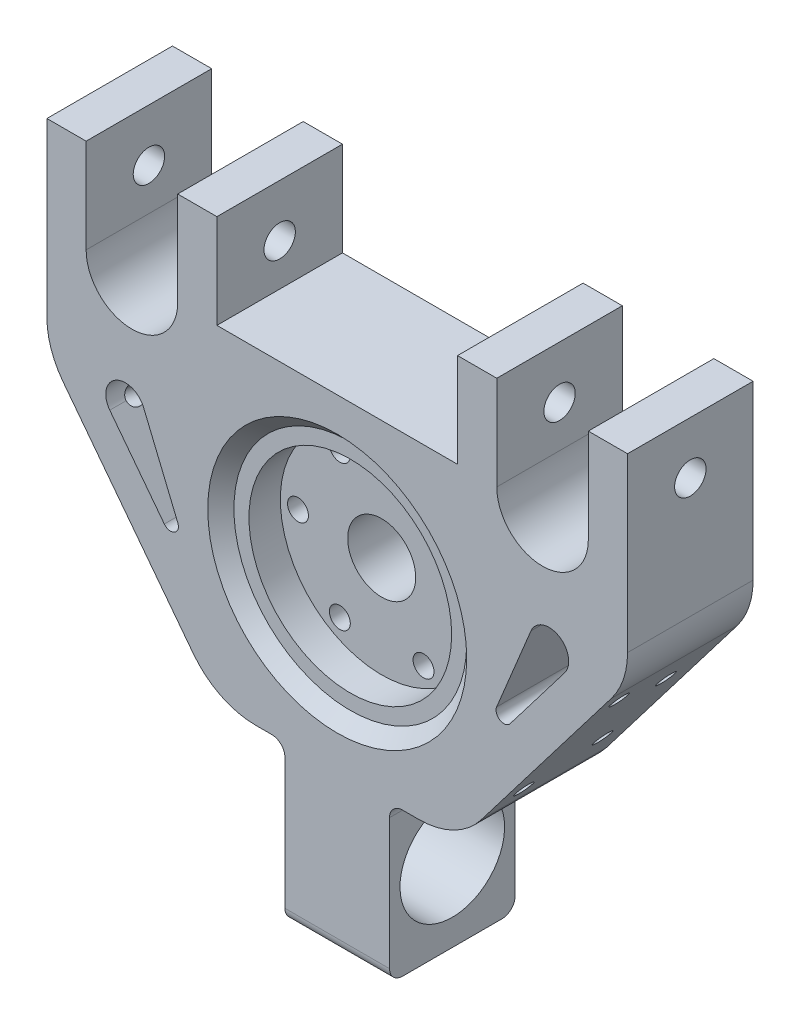
from build123d import *

# Parameters (mm, degrees)
DODANIE_WYCI_GNI_CIE1_DEPTH      = 13.5
DODANIE_WYCI_GNI_CIE1_DEPTH_BACK = 13.5
SZKIC1_W                         = 222
SZKIC1_H                         = 125
SZKIC1_R                         = 13
SZKIC1_R_2                       = 4
SZKIC4_W                         = 15
SZKIC4_H                         = 27
DODANIE_WYCI_GNI_CIE4_DEPTH      = 36
SZKIC13_R                        = 38.75
WYTNIJ_WYCI_GNI_CIE4_DEPTH       = 17
SZKIC15_R                        = 44.5
WYTNIJ_WYCI_GNI_CIE5_DEPTH       = 5
POCHYLENIE1_ANGLE                = 45
DODANIE_WYCI_GNI_CIE6_START      = 21
SZKIC16_R                        = 13
SZKIC16_R_2                      = 4
DODANIE_WYCI_GNI_CIE6_DEPTH      = 21
SZKIC5_R                         = 6
WYTNIJ_WYCI_GNI_CIE3_DEPTH       = 246.308988828
WYTNIJ_WYCI_GNI_CIE6_DEPTH       = 156.971952607
ZAOKR_GLENIE1_R                  = 30
ZAOKR_GLENIE2_R                  = 30
SZKIC19_W                        = 40
SZKIC19_H                        = 60
DODANIE_WYCI_GNI_CIE7_DEPTH      = 48
WYTNIJ_WYCI_GNI_CIE7_REACH       = 184.64
SZKIC23_R                        = 20
WYTNIJ_WYCI_GNI_CIE8_REACH       = 174.137
ZAOKR_GLENIE4_R                  = 5
ZAOKR_GLENIE5_R                  = 5
WYTNIJ_WYCI_GNI_CIE9_DEPTH       = 48
OTW_R_GWINTOWANY_M81_AT_2_COUNT  = 2
OTW_R_GWINTOWANY_M81_AT_2_PITCH  = 26
OTW_R_GWINTOWANY_M82_AT_2_COUNT  = 2
OTW_R_GWINTOWANY_M82_AT_2_PITCH  = 26


with BuildPart() as part:
    # Szkic1 → Dodanie-wyciągnięcie1 (new, two sides: drawn at the far end of the back side and taken through both)
    with BuildSketch(Plane.XY.offset(-DODANIE_WYCI_GNI_CIE1_DEPTH_BACK)):
        Rectangle(SZKIC1_W, SZKIC1_H)
        Circle(SZKIC1_R, mode=Mode.SUBTRACT)
        with Locations((-32, 0)):
            Circle(SZKIC1_R_2, mode=Mode.SUBTRACT)
        with Locations((-16, 27.712812921)):
            Circle(SZKIC1_R_2, mode=Mode.SUBTRACT)
        with Locations((16, 27.712812921)):
            Circle(SZKIC1_R_2, mode=Mode.SUBTRACT)
        with Locations((32, 0)):
            Circle(SZKIC1_R_2, mode=Mode.SUBTRACT)
        with Locations((16, -27.712812921)):
            Circle(SZKIC1_R_2, mode=Mode.SUBTRACT)
        with Locations((-16, -27.712812921)):
            Circle(SZKIC1_R_2, mode=Mode.SUBTRACT)
    extrude(amount=DODANIE_WYCI_GNI_CIE1_DEPTH + DODANIE_WYCI_GNI_CIE1_DEPTH_BACK)

    # Szkic4 → Dodanie-wyciągnięcie4 (add)
    with BuildSketch(Plane(origin=(0, 62.5, 0), x_dir=(1, 0, 0), z_dir=(0, 1, 0))):
        with Locations((-103.5, 0)):
            Rectangle(SZKIC4_W, SZKIC4_H)
        with Locations((-53.5, 0)):
            Rectangle(SZKIC4_W, SZKIC4_H)
        with Locations((53.5, 0)):
            Rectangle(SZKIC4_W, SZKIC4_H)
        with Locations((103.5, 0)):
            Rectangle(SZKIC4_W, SZKIC4_H)
    extrude(amount=DODANIE_WYCI_GNI_CIE4_DEPTH)

    # Szkic13 → Wytnij-wyciągnięcie4 (cut)
    with BuildSketch(Plane.XY.offset(13.5)):
        Circle(SZKIC13_R)
    extrude(amount=-WYTNIJ_WYCI_GNI_CIE4_DEPTH, mode=Mode.SUBTRACT)

    # Szkic15 → Wytnij-wyciągnięcie5 (cut)
    with BuildSketch(Plane.XY.offset(13.5)):
        Circle(SZKIC15_R)
    extrude(amount=-WYTNIJ_WYCI_GNI_CIE5_DEPTH, mode=Mode.SUBTRACT)

    # Pochylenie1
    pochylenie1_faces = [part.faces().sort_by_distance(p)[0] for p in [
        (-44.5, 0, 11),
    ]]
    draft(pochylenie1_faces, Plane.XY.offset(8.5), POCHYLENIE1_ANGLE)

    # Szkic16 → Dodanie-wyciągnięcie6 (add)
    with BuildSketch(Plane(origin=(0, 0, -13.5), x_dir=(-1, 0, 0), z_dir=(0, 0, -1)).offset(DODANIE_WYCI_GNI_CIE6_START)):
        Polygon((-111, 98.5), (-111, -62.5), (111, -62.5), (111, 98.5), (96, 98.5), (96, 62.5), (61, 62.5), (61, 98.5), (46, 98.5), (46, 62.5), (-46, 62.5), (-46, 98.5), (-61, 98.5), (-61, 62.5), (-96, 62.5), (-96, 98.5), align=None)
        with Locations(Location((0, 0, 0), (0, 0, 180))):
            Circle(SZKIC16_R, mode=Mode.SUBTRACT)
        with Locations(Location((32, 0, 0), (0, 0, 180))):
            Circle(SZKIC16_R_2, mode=Mode.SUBTRACT)
        with Locations(Location((16, 27.712812921, 0), (0, 0, 180))):
            Circle(SZKIC16_R_2, mode=Mode.SUBTRACT)
        with Locations(Location((-16, 27.712812921, 0), (0, 0, 180))):
            Circle(SZKIC16_R_2, mode=Mode.SUBTRACT)
        with Locations(Location((-32, 0, 0), (0, 0, 180))):
            Circle(SZKIC16_R_2, mode=Mode.SUBTRACT)
        with Locations(Location((-16, -27.712812921, 0), (0, 0, 180))):
            Circle(SZKIC16_R_2, mode=Mode.SUBTRACT)
        with Locations(Location((16, -27.712812921, 0), (0, 0, 180))):
            Circle(SZKIC16_R_2, mode=Mode.SUBTRACT)
    extrude(amount=-DODANIE_WYCI_GNI_CIE6_DEPTH)

    # Szkic5 → Wytnij-wyciągnięcie3 (cut, through all)
    with BuildSketch(Plane.ZY.offset(111)):
        with Locations((-10.5, 78.5)):
            Circle(SZKIC5_R)
    extrude(amount=-WYTNIJ_WYCI_GNI_CIE3_DEPTH, mode=Mode.SUBTRACT)

    # Szkic18 → Wytnij-wyciągnięcie6 (cut, through all)
    with BuildSketch(Plane(origin=(0, 0, -34.5), x_dir=(-1, 0, 0), z_dir=(0, 0, -1))):
        Polygon((111, 22.5), (46, -62.5), (111, -62.5), align=None)
        Polygon((-111, -62.5), (-46, -62.5), (-111, 22.5), align=None)
    extrude(amount=-WYTNIJ_WYCI_GNI_CIE6_DEPTH, mode=Mode.SUBTRACT)

    # Zaokrąglenie1
    zaokr_glenie1_edges = [part.edges().sort_by_distance(p)[0] for p in [
        (-111, 22.5, -10.5),
    ]]
    fillet(zaokr_glenie1_edges, radius=ZAOKR_GLENIE1_R)

    # Zaokrąglenie2
    zaokr_glenie2_edges = [part.edges().sort_by_distance(p)[0] for p in [
        (-46, -62.5, -10.5),
        (111, 22.5, -10.5),
        (46, -62.5, -10.5),
    ]]
    fillet(zaokr_glenie2_edges, radius=ZAOKR_GLENIE2_R)

    # Szkic19 → Dodanie-wyciągnięcie7 (add)
    with BuildSketch(Plane(origin=(0, 0, -34.5), x_dir=(-1, 0, 0), z_dir=(0, 0, -1))):
        with Locations((0, -92.5)):
            Rectangle(SZKIC19_W, SZKIC19_H)
    extrude(amount=-DODANIE_WYCI_GNI_CIE7_DEPTH)

    # Szkic23 → Wytnij-wyciągnięcie7 (cut, up to next)
    with BuildSketch(Plane(origin=(20, 0, 0), x_dir=(0, 0, -1), z_dir=(1, 0, 0)), mode=Mode.PRIVATE) as wytnij_wyci_gni_cie7_sk1:
        with Locations(Location((10.5, -92.5, 0), (0, 0, 90))):
            Circle(SZKIC23_R)
    wytnij_wyci_gni_cie7_tool1 = extrude(wytnij_wyci_gni_cie7_sk1.sketch, amount=-WYTNIJ_WYCI_GNI_CIE7_REACH, mode=Mode.PRIVATE) & part.part
    add(wytnij_wyci_gni_cie7_tool1.solids().sort_by_distance((20, -92.5, -10.5))[0], mode=Mode.SUBTRACT)

    # Szkic24 → Wytnij-wyciągnięcie8 (cut, up to next)
    with BuildSketch(Plane(origin=(0, 0, -34.5), x_dir=(-1, 0, 0), z_dir=(0, 0, -1)), mode=Mode.PRIVATE) as wytnij_wyci_gni_cie8_sk1:
        with BuildLine():
            Line((-96, 62.5), (-61, 62.5))
            ThreePointArc((-61, 62.5), (-78.5, 45), (-96, 62.5))
        make_face()
    wytnij_wyci_gni_cie8_tool1 = extrude(wytnij_wyci_gni_cie8_sk1.sketch, amount=-WYTNIJ_WYCI_GNI_CIE8_REACH, mode=Mode.PRIVATE) & part.part
    # Szkic24 → Wytnij-wyciągnięcie8 (cut, up to next)
    with BuildSketch(Plane(origin=(0, 0, -34.5), x_dir=(-1, 0, 0), z_dir=(0, 0, -1)), mode=Mode.PRIVATE) as wytnij_wyci_gni_cie8_sk2:
        with BuildLine():
            Line((61, 62.5), (96, 62.5))
            ThreePointArc((96, 62.5), (78.5, 45), (61, 62.5))
        make_face()
    wytnij_wyci_gni_cie8_tool2 = extrude(wytnij_wyci_gni_cie8_sk2.sketch, amount=-WYTNIJ_WYCI_GNI_CIE8_REACH, mode=Mode.PRIVATE) & part.part
    add(wytnij_wyci_gni_cie8_tool1.solids().sort_by_distance((78.5, 55.072769, -34.5))[0], mode=Mode.SUBTRACT)
    add(wytnij_wyci_gni_cie8_tool2.solids().sort_by_distance((-78.5, 55.072769, -34.5))[0], mode=Mode.SUBTRACT)

    # Zaokrąglenie4
    zaokr_glenie4_edges = [part.edges().sort_by_distance(p)[0] for p in [
        (20, -62.5, -10.5),
        (-20, -62.5, -10.5),
    ]]
    fillet(zaokr_glenie4_edges, radius=ZAOKR_GLENIE4_R)

    # Zaokrąglenie5
    zaokr_glenie5_edges = [part.edges().sort_by_distance(p)[0] for p in [
        (0, -122.5, -34.5),
        (0, -122.5, 13.5),
    ]]
    fillet(zaokr_glenie5_edges, radius=ZAOKR_GLENIE5_R)

    # Szkic25 → Wytnij-wyciągnięcie9 (cut)
    with BuildSketch(Plane.XY.offset(13.5)):
        with BuildLine():
            Line((-60.951491344, -10.353512592), (-74.069286372, 21.36621852))
            ThreePointArc((-74.069286372, 21.36621852), (-84.742802137, 24.999340902), (-86.957683747, 13.944124193))
            Line((-86.957683747, 13.944124193), (-66.106850294, -13.322350323))
            ThreePointArc((-66.106850294, -13.322350323), (-62.22665594, -14.099736361), (-60.951491344, -10.353512592))
        make_face()
        with BuildLine():
            Line((66.106850294, -13.322350323), (86.957683747, 13.944124193))
            ThreePointArc((86.957683747, 13.944124193), (84.742802137, 24.999340902), (74.069286372, 21.36621852))
            Line((74.069286372, 21.36621852), (60.951491344, -10.353512592))
            ThreePointArc((60.951491344, -10.353512592), (62.22665594, -14.099736361), (66.106850294, -13.322350323))
        make_face()
    extrude(amount=-WYTNIJ_WYCI_GNI_CIE9_DEPTH, mode=Mode.SUBTRACT)

    # Szkic28 → Otwór gwintowany M81 (revolve, cut)
    with BuildSketch(Plane(origin=(-92.067147824, -2.258345153, -20.15), x_dir=(0.6074501075707972, -0.7943578329771962, 0), z_dir=(0, 0, 1))):
        Polygon((0, 0), (0, 47.042926105), (3.4, 45), (3.4, 0), align=None)
    otw_r_gwintowany_m81 = revolve(axis=Axis((-97.111320063, -6.115653336, -20.15), (0.7943578329771961, 0.6074501075707972, 0)), mode=Mode.SUBTRACT)

    # Otwór gwintowany M81 at 2: Otwór gwintowany M81 ×2
    with Locations(*[Vector(-0.23363465675799897, 0.30552224345276774, 0.9230769230769231) * (i * OTW_R_GWINTOWANY_M81_AT_2_PITCH) for i in range(1, OTW_R_GWINTOWANY_M81_AT_2_COUNT)]):
        add(otw_r_gwintowany_m81, mode=Mode.SUBTRACT)

    # Szkic30 → Otwór gwintowany M82 (revolve, cut)
    with BuildSketch(Plane(origin=(-61.694642445, -41.976236802, 3.85), x_dir=(0.6074501075707972, -0.7943578329771962, 0), z_dir=(0, 0, 1))):
        Polygon((0, 0), (0, 27.042926105), (3.4, 25), (3.4, 0), align=None)
    otw_r_gwintowany_m82 = revolve(axis=Axis((-66.738814685, -45.833544985, 3.85), (0.7943578329771961, 0.6074501075707972, 0)), mode=Mode.SUBTRACT)

    # Otwór gwintowany M82 at 2: Otwór gwintowany M82 ×2
    with Locations(*[Vector(-0.2336346567579986, 0.3055222434527673, -0.9230769230769232) * (i * OTW_R_GWINTOWANY_M82_AT_2_PITCH) for i in range(1, OTW_R_GWINTOWANY_M82_AT_2_COUNT)]):
        add(otw_r_gwintowany_m82, mode=Mode.SUBTRACT)

    # Lustro1: Otwór gwintowany M81, Otwór gwintowany M82 across plane
    add(otw_r_gwintowany_m81.mirror(Plane(origin=(0, 0, 0), x_dir=(0, 0, 1), z_dir=(1, 0, 0))), mode=Mode.SUBTRACT)
    add(otw_r_gwintowany_m82.mirror(Plane(origin=(0, 0, 0), x_dir=(0, 0, 1), z_dir=(1, 0, 0))), mode=Mode.SUBTRACT)

    # Lustro1 copy 1 sketch → Lustro1 copy 1 (revolve, cut)
    with BuildSketch(Plane(origin=(98.1416489, 5.685233176, 3.85), x_dir=(-0.6074501075707972, -0.7943578329771962, 0), z_dir=(0, 0, 1))):
        Polygon((0, 0), (0, -47.042926105), (3.4, -45), (3.4, 0), align=None)
    revolve(axis=Axis((103.185821139, 1.827924993, 3.85), (0.7943578329771961, -0.6074501075707972, 0)), mode=Mode.SUBTRACT)

    # Lustro1 copy 2 sketch → Lustro1 copy 2 (revolve, cut)
    with BuildSketch(Plane(origin=(67.769143521, -34.032658472, -20.15), x_dir=(-0.6074501075707972, -0.7943578329771962, 0), z_dir=(0, 0, 1))):
        Polygon((0, 0), (0, -27.042926105), (3.4, -25), (3.4, 0), align=None)
    revolve(axis=Axis((72.813315761, -37.889966655, -20.15), (0.7943578329771961, -0.6074501075707972, 0)), mode=Mode.SUBTRACT)


solid = part.part
